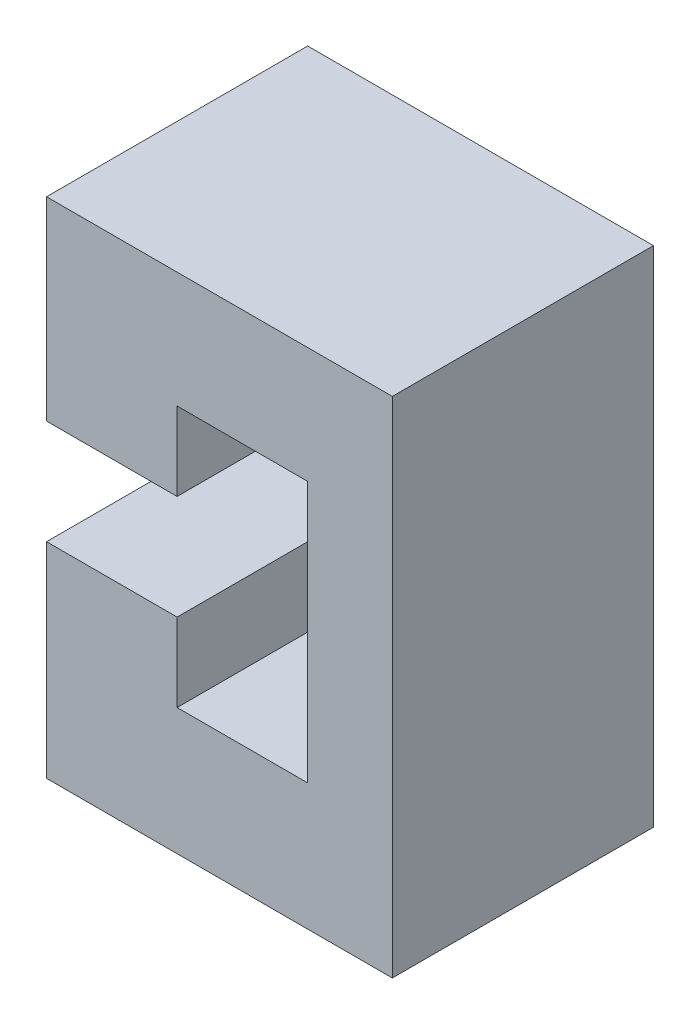
from build123d import *

# Parameters (mm, degrees)
BOSS_EXTRUDE1_DEPTH = 10


with BuildPart() as part:
    # Sketch1 → Boss-Extrude1 (new body)
    with BuildSketch(Plane.XY):
        Polygon((-77.636509301, -36.821009209), (-77.636509301, -44.670593209), (-64.394427519, -44.670593209), (-64.394427519, -25.380983657), (-77.636509301, -25.380983657), (-77.636509301, -32.821009209), (-72.636509301, -32.821009209), (-72.636509301, -29.821009209), (-67.636509301, -29.821009209), (-67.636509301, -39.821009209), (-72.636509301, -39.821009209), (-72.636509301, -36.821009209), align=None)
    extrude(amount=BOSS_EXTRUDE1_DEPTH)


solid = part.part
